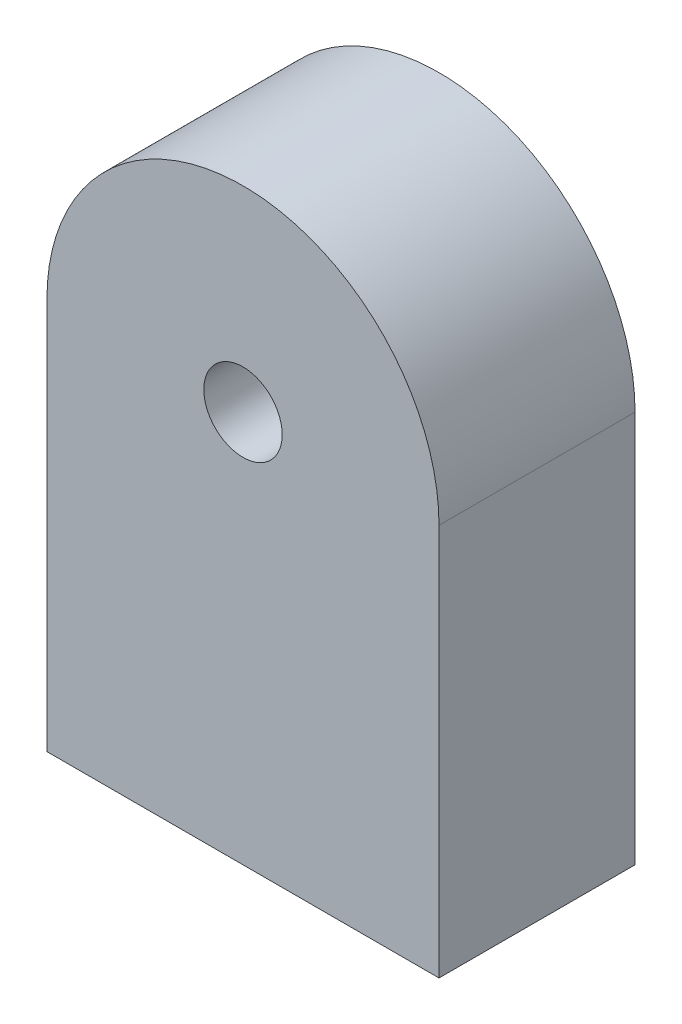
from build123d import *

# Parameters (mm, degrees)
SALIENTE_EXTRUIR1_DEPTH = 7.5
CROQUIS3_R              = 3
CORTAR_EXTRUIR1_DEPTH   = 57.124860802


with BuildPart() as part:
    # Croquis2 → Saliente-Extruir1 (new, symmetric)
    with BuildSketch(Plane.XY):
        with BuildLine():
            Line((0, 0), (-30, 0))
            Line((-30, 0), (-30, 30))
            ThreePointArc((-30, 30), (-15, 45), (0, 30))
            Line((0, 30), (0, 0))
        make_face()
    extrude(amount=SALIENTE_EXTRUIR1_DEPTH, both=True)

    # Croquis3 → Cortar-Extruir1 (cut, through all)
    with BuildSketch(Plane.XY.offset(7.5)):
        with Locations((-15, 30)):
            Circle(CROQUIS3_R)
    extrude(amount=-CORTAR_EXTRUIR1_DEPTH, mode=Mode.SUBTRACT)


solid = part.part
